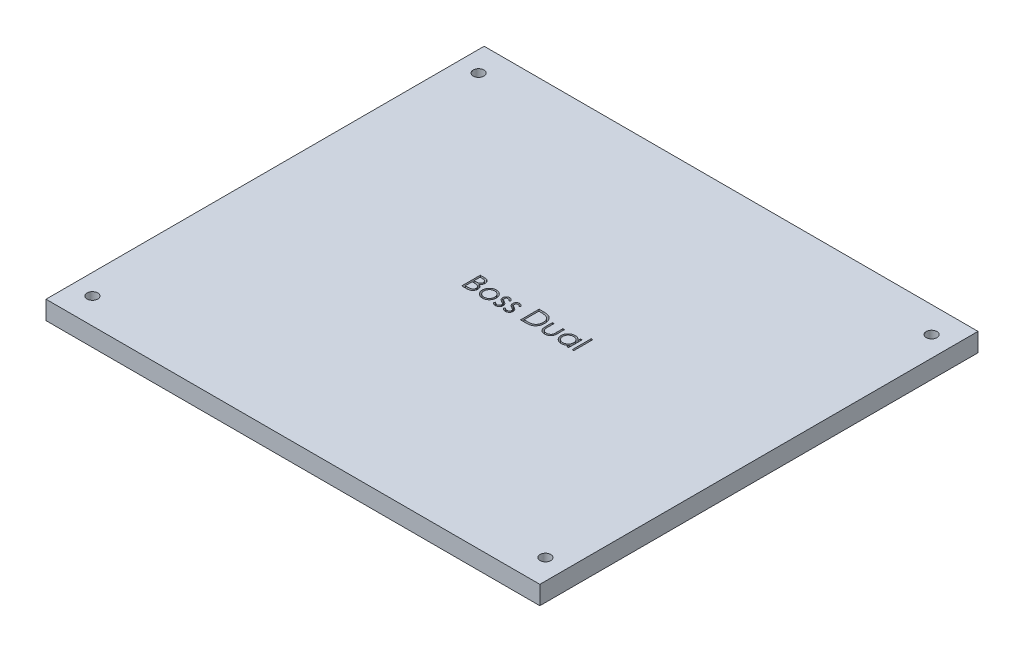
from build123d import *

# Parameters (mm, degrees)
SKETCH2_W           = 168.91
SKETCH2_H           = 149.86
BOSS_EXTRUDE1_DEPTH = 6.35
SKETCH3_R           = 1.8288
CUT_EXTRUDE1_DEPTH  = 114.081715697
SKETCH5_W           = 0.569871795
SKETCH5_H           = 6.512820513
CUT_EXTRUDE2_DEPTH  = 2.54


with BuildPart() as part:
    # Sketch2 → Boss-Extrude1 (new body)
    with BuildSketch(Plane(origin=(0, 0, 0), x_dir=(1, 0, 0), z_dir=(0, 1, 0))):
        Rectangle(SKETCH2_W, SKETCH2_H)
    extrude(amount=BOSS_EXTRUDE1_DEPTH)

    # Sketch3 → Cut-Extrude1 (cut, through all)
    with BuildSketch(Plane(origin=(0, 6.35, 0), x_dir=(1, 0, 0), z_dir=(0, 1, 0))):
        with Locations(Location((-77.47, 66.04, 0), (0, 0, 270))):
            Circle(SKETCH3_R)
        with Locations(Location((77.47, 66.04, 0), (0, 0, 270))):
            Circle(SKETCH3_R)
        with Locations(Location((77.47, -66.04, 0), (0, 0, 270))):
            Circle(SKETCH3_R)
        with Locations(Location((-77.47, -66.04, 0), (0, 0, 270))):
            Circle(SKETCH3_R)
    extrude(amount=-CUT_EXTRUDE1_DEPTH, mode=Mode.SUBTRACT)

    # Sketch5 → Cut-Extrude2 (cut)
    # profile 1 of 8: a face of its own
    with BuildSketch(Plane(origin=(0, 6.35, 0), x_dir=(1, 0, 0), z_dir=(0, 1, 0))):
        with BuildLine():
            Line((-17.296209186, 6.449507207), (-16.057246847, 6.449507207))
            add(Edge.make_bspline(
                [(-16.057246847, 6.449507207), (-15.996598036, 6.449188346), (-15.879045548, 6.448570313), (-15.70810456, 6.438985204), (-15.547996004, 6.425915688), (-15.398673445, 6.405178235), (-15.260205885, 6.38015601), (-15.132176029, 6.349854144), (-15.014991002, 6.313520145), (-14.875086466, 6.255741892), (-14.715573267, 6.169884144), (-14.542856183, 6.043013747), (-14.395165635, 5.887833421), (-14.267827602, 5.712786317), (-14.166588428, 5.520225703), (-14.093346989, 5.314741175), (-14.0469777, 5.098983157), (-14.04220897, 4.950859106), (-14.03979893, 4.875999595)],
                knots=[0, 0, 0, 0, 1.001505555, 1.941167018, 2.826882275, 3.653841531, 4.429895133, 5.150066043, 5.825578002, 6.45369114, 7.647487171, 8.808567382, 9.977351308, 11.170798116, 12.373658725, 13.556498008, 14.765093433, 16, 16, 16, 16], degree=3))
            add(Edge.make_bspline(
                [(-14.03979893, 4.875999595), (-14.041782341, 4.805872816), (-14.04567993, 4.66806708), (-14.082950364, 4.466510625), (-14.141299006, 4.274647699), (-14.222407101, 4.093178515), (-14.327820722, 3.926203245), (-14.452749386, 3.772374919), (-14.603474442, 3.638206573), (-14.716401463, 3.563198736), (-14.773763273, 3.525098153)],
                knots=[0, 0, 0, 0, 1.044552857, 2.05264487, 3.044412934, 4.028983338, 5.005914585, 5.980388656, 6.974128949, 8, 8, 8, 8], degree=3))
            add(Edge.make_bspline(
                [(-14.773763273, 3.525098153), (-14.701626497, 3.497403083), (-14.563610976, 3.444415555), (-14.373680639, 3.35073407), (-14.21004142, 3.248839956), (-14.071435169, 3.137566456), (-13.952893995, 3.017626185), (-13.849383659, 2.887260478), (-13.761061737, 2.744768731), (-13.685382576, 2.591636603), (-13.626329833, 2.429427725), (-13.582104977, 2.259663602), (-13.556764034, 2.082952981), (-13.553157885, 1.962692364), (-13.551337392, 1.901981166)],
                knots=[0, 0, 0, 0, 1.27268992, 2.434971085, 3.483601985, 4.442670788, 5.356604649, 6.2567628, 7.179492994, 8.113709626, 9.066344395, 10.018646069, 10.999752585, 12, 12, 12, 12], degree=3))
            add(Edge.make_bspline(
                [(-13.551337392, 1.901981166), (-13.553109669, 1.839992698), (-13.556596676, 1.71802865), (-13.582323196, 1.538858621), (-13.625882576, 1.367635503), (-13.685883084, 1.203251814), (-13.764191855, 1.04602557), (-13.85949259, 0.895778649), (-13.973124141, 0.754020649), (-14.100238204, 0.619176361), (-14.244042382, 0.497931661), (-14.399192394, 0.389953165), (-14.567642146, 0.301151024), (-14.74662505, 0.226554813), (-14.93814888, 0.169573182), (-15.141353611, 0.129708655), (-15.356063987, 0.102848088), (-15.503401678, 0.10063973), (-15.57896159, 0.099507207)],
                knots=[0, 0, 0, 0, 0.978564426, 1.925352924, 2.850884081, 3.763762016, 4.682927383, 5.618979971, 6.567305752, 7.547517671, 8.540179244, 9.531824382, 10.526200242, 11.540722885, 12.589160233, 13.674978461, 14.80764778, 16, 16, 16, 16], degree=3))
            Line((-15.57896159, 0.099507207), (-17.296209186, 0.099507207))
            Line((-17.296209186, 0.099507207), (-17.296209186, 6.449507207))
        make_face()
        with BuildLine():
            Line((-16.726337392, 5.798225156), (-16.726337392, 3.762968746))
            Line((-16.726337392, 3.762968746), (-16.343454779, 3.762968746))
            add(Edge.make_bspline(
                [(-16.343454779, 3.762968746), (-16.287486251, 3.76369432), (-16.179343647, 3.765096278), (-16.022734692, 3.769112231), (-15.877365016, 3.780357252), (-15.743485548, 3.791599042), (-15.621307114, 3.809877223), (-15.511100394, 3.83163436), (-15.411135796, 3.854644773), (-15.295856907, 3.893777985), (-15.165095986, 3.951613196), (-15.025698783, 4.041369242), (-14.902809102, 4.148274854), (-14.799037061, 4.271629885), (-14.714107679, 4.407458536), (-14.65511851, 4.553593591), (-14.615118438, 4.706392973), (-14.611505231, 4.811291803), (-14.609670725, 4.864551278)],
                knots=[0, 0, 0, 0, 1.156816544, 2.235205308, 3.236616184, 4.169592532, 5.011045266, 5.787822928, 6.49130361, 7.128639758, 8.301311294, 9.436451833, 10.541879658, 11.654887649, 12.756523258, 13.837046038, 14.901820046, 16, 16, 16, 16], degree=3))
            add(Edge.make_bspline(
                [(-14.609670725, 4.864551278), (-14.610625366, 4.899795178), (-14.612497999, 4.968929936), (-14.627834705, 5.069712335), (-14.65390159, 5.164497429), (-14.687382951, 5.254584172), (-14.734171, 5.337155672), (-14.789258998, 5.415066898), (-14.855817322, 5.485664599), (-14.931577018, 5.55164926), (-15.018678376, 5.610150046), (-15.117069434, 5.66138686), (-15.228081363, 5.702645126), (-15.349843257, 5.738778717), (-15.484229373, 5.764157478), (-15.62968892, 5.785300053), (-15.787413338, 5.796063742), (-15.896533739, 5.797488615), (-15.952939956, 5.798225156)],
                knots=[0, 0, 0, 0, 0.91205012, 1.789085906, 2.630437955, 3.453916878, 4.269457761, 5.079663411, 5.91843418, 6.774407191, 7.675494373, 8.627863946, 9.638891023, 10.736472738, 11.911756761, 13.175263542, 14.539845004, 16, 16, 16, 16], degree=3))
            Line((-15.952939956, 5.798225156), (-16.726337392, 5.798225156))
        make_face(mode=Mode.SUBTRACT)
        with BuildLine():
            Line((-16.726337392, 3.111686695), (-16.726337392, 0.750789259))
            Line((-16.726337392, 0.750789259), (-15.914778898, 0.750789259))
            add(Edge.make_bspline(
                [(-15.914778898, 0.750789259), (-15.856687418, 0.751485486), (-15.744723749, 0.752827373), (-15.58306866, 0.757208065), (-15.433239315, 0.767172622), (-15.295919411, 0.782858663), (-15.169626161, 0.79987385), (-15.055874615, 0.822754317), (-14.953742678, 0.848968859), (-14.835316434, 0.889489429), (-14.701960069, 0.95243874), (-14.558248944, 1.047351694), (-14.430475662, 1.160423981), (-14.321971835, 1.291290068), (-14.23304827, 1.433586904), (-14.168359087, 1.584436325), (-14.12846139, 1.741345782), (-14.123631454, 1.848328246), (-14.121209186, 1.901981166)],
                knots=[0, 0, 0, 0, 1.160039823, 2.235823828, 3.228722157, 4.157150951, 4.99529583, 5.772374946, 6.472645482, 7.099169577, 8.269452708, 9.405989375, 10.527446681, 11.663510218, 12.788923519, 13.866172445, 14.929861265, 16, 16, 16, 16], degree=3))
            add(Edge.make_bspline(
                [(-14.121209186, 1.901981166), (-14.121710119, 1.935533369), (-14.122703903, 2.002096576), (-14.137691019, 2.099915277), (-14.159487611, 2.194667933), (-14.187666069, 2.286611833), (-14.228704245, 2.374084673), (-14.276613263, 2.45881646), (-14.332786092, 2.540919201), (-14.420314793, 2.644718575), (-14.547626822, 2.76431087), (-14.7285234, 2.881400338), (-14.93421314, 2.975829931), (-15.083397306, 3.015924695), (-15.160461991, 3.036636614)],
                knots=[0, 0, 0, 0, 0.723448775, 1.435228256, 2.130040452, 2.821711965, 3.505591119, 4.210454504, 4.921174351, 5.648778258, 7.137944449, 8.670945889, 10.280296675, 12, 12, 12, 12], degree=3))
            add(Edge.make_bspline(
                [(-15.160461991, 3.036636614), (-15.191357636, 3.042905124), (-15.258345768, 3.056496545), (-15.367579521, 3.070843379), (-15.492286026, 3.08362513), (-15.632753246, 3.093079659), (-15.789158901, 3.102852388), (-15.961837025, 3.106652992), (-16.150082439, 3.111187364), (-16.280697171, 3.111515993), (-16.34854292, 3.111686695)],
                knots=[0, 0, 0, 0, 0.634451884, 1.375622551, 2.216452059, 3.157844607, 4.20941857, 5.370758133, 6.634282058, 8, 8, 8, 8], degree=3))
            Line((-16.34854292, 3.111686695), (-16.726337392, 3.111686695))
        make_face(mode=Mode.SUBTRACT)
    # profile 2 of 8: a face of its own
    with BuildSketch(Plane(origin=(0, 6.35, 0), x_dir=(1, 0, 0), z_dir=(0, 1, 0))):
        with BuildLine():
            add(Edge.make_bspline(
                [(-10.17026768, 4.821302079), (-10.083197799, 4.819448077), (-9.912475042, 4.815812831), (-9.662452163, 4.776959965), (-9.423791702, 4.717546889), (-9.195579611, 4.635411341), (-8.980738618, 4.525316945), (-8.776139361, 4.393945802), (-8.582342787, 4.238311668), (-8.46618672, 4.117919173), (-8.407226815, 4.05680889)],
                knots=[0, 0, 0, 0, 1.054011418, 2.066658804, 3.057071809, 4.030435133, 4.997543892, 5.974964718, 6.972108034, 8, 8, 8, 8], degree=3))
            add(Edge.make_bspline(
                [(-8.407226815, 4.05680889), (-8.356459555, 3.998363516), (-8.255907522, 3.882603846), (-8.126974004, 3.694905806), (-8.015900602, 3.500523052), (-7.926886373, 3.296874331), (-7.856700687, 3.085737427), (-7.806870067, 2.866386636), (-7.777230199, 2.639306377), (-7.773233388, 2.485085128), (-7.771209186, 2.406979163)],
                knots=[0, 0, 0, 0, 1.025258237, 2.030674902, 3.01204498, 3.988269485, 4.97094183, 5.956517959, 6.965070386, 8, 8, 8, 8], degree=3))
            add(Edge.make_bspline(
                [(-7.771209186, 2.406979163), (-7.772989613, 2.328420486), (-7.776507818, 2.173184879), (-7.809788379, 1.944549744), (-7.861551921, 1.722853423), (-7.935632542, 1.509024078), (-8.030625111, 1.302408091), (-8.146541073, 1.103907909), (-8.284193864, 0.913131896), (-8.440229687, 0.731699989), (-8.612680948, 0.564484143), (-8.799763102, 0.418745711), (-8.997799707, 0.293883802), (-9.209424076, 0.193306305), (-9.432703659, 0.11400442), (-9.668120054, 0.058305819), (-9.915307539, 0.024629621), (-10.084085498, 0.020305138), (-10.17026768, 0.018096951)],
                knots=[0, 0, 0, 0, 0.998656419, 1.973391657, 2.932242238, 3.890759089, 4.846373663, 5.82037756, 6.809684879, 7.83454468, 8.860553229, 9.859544525, 10.845671541, 11.83227036, 12.833544569, 13.85385346, 14.904124723, 16, 16, 16, 16], degree=3))
            add(Edge.make_bspline(
                [(-10.17026768, 0.018096951), (-10.2568721, 0.02031255), (-10.426491231, 0.024651912), (-10.674551227, 0.058174982), (-10.910389535, 0.113978751), (-11.133961421, 0.193566916), (-11.346495644, 0.293887017), (-11.545679717, 0.418368225), (-11.732913849, 0.564527364), (-11.905401592, 0.731688278), (-12.061427633, 0.913134913), (-12.199082948, 1.103907126), (-12.314998254, 1.302408295), (-12.409990996, 1.509024024), (-12.484071571, 1.722853437), (-12.535835125, 1.94454974), (-12.569115682, 2.17318488), (-12.572633888, 2.328420487), (-12.574414315, 2.406979163)],
                knots=[0, 0, 0, 0, 1.099876186, 2.154163076, 3.173186993, 4.173200201, 5.163417411, 6.152872554, 7.150605724, 8.17532212, 9.198891216, 10.186952605, 11.159729845, 12.11414092, 13.071450619, 14.029093627, 15.002601286, 16, 16, 16, 16], degree=3))
            add(Edge.make_bspline(
                [(-12.574414315, 2.406979163), (-12.572376309, 2.48466061), (-12.568341407, 2.638456526), (-12.538731341, 2.865109907), (-12.489095103, 3.084089456), (-12.418825283, 3.294411391), (-12.32899058, 3.497167682), (-12.219477957, 3.692030733), (-12.089229238, 3.878880028), (-11.989077126, 3.994490087), (-11.938396686, 4.052992784)],
                knots=[0, 0, 0, 0, 1.031353054, 2.041901799, 3.029428768, 4.008703097, 4.981709435, 5.96992636, 6.972712378, 8, 8, 8, 8], degree=3))
            add(Edge.make_bspline(
                [(-11.938396686, 4.052992784), (-11.879525671, 4.114633031), (-11.763745461, 4.235859423), (-11.568984198, 4.39103986), (-11.364888265, 4.525144736), (-11.147673042, 4.633051584), (-10.919648429, 4.718030038), (-10.679764946, 4.777113187), (-10.428893653, 4.815672845), (-10.257335484, 4.819406968), (-10.17026768, 4.821302079)],
                knots=[0, 0, 0, 0, 1.027980169, 2.021703884, 2.998553061, 3.971491411, 4.943284454, 5.930300938, 6.949603206, 8, 8, 8, 8], degree=3))
        make_face()
        with BuildLine():
            add(Edge.make_bspline(
                [(-10.172811751, 4.251430284), (-10.234384274, 4.249680239), (-10.355939836, 4.246225327), (-10.53486394, 4.219947385), (-10.707112505, 4.178314057), (-10.873012322, 4.119160983), (-11.032003935, 4.042781552), (-11.184239565, 3.948967813), (-11.330166991, 3.838962306), (-11.466931592, 3.712937173), (-11.592448073, 3.575270998), (-11.702172402, 3.428588975), (-11.795472238, 3.275270318), (-11.873196526, 3.115155592), (-11.931085281, 2.946622213), (-11.973127765, 2.771578782), (-11.999380916, 2.589668669), (-12.002803345, 2.466005107), (-12.00454252, 2.403163057)],
                knots=[0, 0, 0, 0, 1.021534396, 2.016698045, 2.994645724, 3.958388632, 4.93408049, 5.916473867, 6.921342795, 7.962252576, 8.998418191, 10.008913653, 10.997312074, 11.973003931, 12.956656626, 13.948281152, 14.957379055, 16, 16, 16, 16], degree=3))
            add(Edge.make_bspline(
                [(-12.00454252, 2.403163057), (-12.001627283, 2.321970093), (-11.995841082, 2.160817243), (-11.948787153, 1.923488492), (-11.870072045, 1.695647132), (-11.763777981, 1.478628831), (-11.630598127, 1.277837698), (-11.473685877, 1.098819434), (-11.294725278, 0.944268033), (-11.095849628, 0.816032785), (-10.881121079, 0.714142942), (-10.653870325, 0.641936229), (-10.416850781, 0.594997587), (-10.254870025, 0.590332198), (-10.172811751, 0.587968746)],
                knots=[0, 0, 0, 0, 1.016792936, 2.018143844, 3.017858371, 4.030088057, 5.03801393, 6.028138512, 7.003788237, 7.991172063, 8.984598303, 9.972568034, 10.972917682, 12, 12, 12, 12], degree=3))
            add(Edge.make_bspline(
                [(-10.172811751, 0.587968746), (-10.090758196, 0.590345969), (-9.928786757, 0.59503854), (-9.692096536, 0.641699828), (-9.465466902, 0.714459326), (-9.250961384, 0.815918193), (-9.052176261, 0.944755002), (-8.871928569, 1.097946715), (-8.716356089, 1.278311845), (-8.583307977, 1.478894791), (-8.475273173, 1.695310687), (-8.396926507, 1.923530543), (-8.349759458, 2.160806534), (-8.343988526, 2.321966505), (-8.341080981, 2.403163057)],
                knots=[0, 0, 0, 0, 1.02726834, 2.027799167, 3.010890988, 4.004497153, 4.992059811, 5.971914811, 6.958719428, 7.966827853, 8.981595046, 9.981490638, 10.983022906, 12, 12, 12, 12], degree=3))
            add(Edge.make_bspline(
                [(-8.341080981, 2.403163057), (-8.342819557, 2.466005483), (-8.346240808, 2.589669784), (-8.372502529, 2.771574521), (-8.414513294, 2.946637846), (-8.472518943, 3.115097909), (-8.549905511, 3.275684882), (-8.64500455, 3.428138815), (-8.754280839, 3.57577912), (-8.881311901, 3.712492154), (-9.017933743, 3.839011435), (-9.163920313, 3.94901047), (-9.315930202, 4.04236925), (-9.474459917, 4.119814286), (-9.640381004, 4.17777589), (-9.812388224, 4.220187778), (-9.990548922, 4.246114278), (-10.1116689, 4.249646949), (-10.172811751, 4.251430284)],
                knots=[0, 0, 0, 0, 1.042956736, 2.052379634, 3.044323526, 4.02829302, 5.004299113, 5.996692471, 7.007513377, 8.048758398, 9.090003419, 10.095195979, 11.07790575, 12.047570684, 13.018257071, 13.989683339, 14.985167495, 16, 16, 16, 16], degree=3))
        make_face(mode=Mode.SUBTRACT)
    # profile 3 of 8: a face of its own
    with BuildSketch(Plane(origin=(0, 6.35, 0), x_dir=(1, 0, 0), z_dir=(0, 1, 0))):
        with BuildLine():
            Line((-4.433388674, 4.161115781), (-4.820087392, 3.762968746))
            add(Edge.make_bspline(
                [(-4.820087392, 3.762968746), (-4.853453019, 3.801636883), (-4.917778022, 3.876184499), (-5.019797995, 3.975856034), (-5.121440818, 4.059561623), (-5.221315094, 4.13023215), (-5.32193224, 4.183661316), (-5.422111505, 4.222659137), (-5.521956617, 4.246792413), (-5.588696995, 4.249902894), (-5.621469603, 4.251430284)],
                knots=[0, 0, 0, 0, 1.26578478, 2.440284043, 3.530471711, 4.527705817, 5.468200915, 6.346673037, 7.188140097, 8, 8, 8, 8], degree=3))
            add(Edge.make_bspline(
                [(-5.621469603, 4.251430284), (-5.661636782, 4.249480158), (-5.740680105, 4.245642584), (-5.853938375, 4.207336789), (-5.959077366, 4.148538078), (-6.050076459, 4.065137934), (-6.12716125, 3.969408474), (-6.183428928, 3.862372285), (-6.217838641, 3.747259406), (-6.222201512, 3.667376664), (-6.224414315, 3.626860973)],
                knots=[0, 0, 0, 0, 0.99966794, 1.967205029, 2.953328237, 3.988086729, 5.028030931, 6.008226631, 6.989793394, 8, 8, 8, 8], degree=3))
            add(Edge.make_bspline(
                [(-6.224414315, 3.626860973), (-6.222398984, 3.59019055), (-6.218374003, 3.516953078), (-6.1870836, 3.408915931), (-6.137252297, 3.303583876), (-6.090679231, 3.239062603), (-6.066681943, 3.205817304)],
                knots=[0, 0, 0, 0, 0.960159726, 1.917612774, 2.927026955, 4, 4, 4, 4], degree=3))
            add(Edge.make_bspline(
                [(-6.066681943, 3.205817304), (-6.05223389, 3.188065272), (-6.02148303, 3.15028231), (-5.963773296, 3.097842462), (-5.898418183, 3.039890092), (-5.819823439, 2.981947545), (-5.731375146, 2.920929987), (-5.631155302, 2.859240402), (-5.522344414, 2.792176374), (-5.444443872, 2.74964147), (-5.403951574, 2.727532047)],
                knots=[0, 0, 0, 0, 0.66740084, 1.420478572, 2.27185888, 3.217733974, 4.268547843, 5.408967954, 6.65319498, 8, 8, 8, 8], degree=3))
            add(Edge.make_bspline(
                [(-5.403951574, 2.727532047), (-5.35457837, 2.699873438), (-5.259205597, 2.646446112), (-5.123691577, 2.56351565), (-5.000706517, 2.481090066), (-4.889208377, 2.400050869), (-4.791342524, 2.318130666), (-4.704139692, 2.23846945), (-4.629774944, 2.158660276), (-4.588129963, 2.102901627), (-4.568224411, 2.076249996)],
                knots=[0, 0, 0, 0, 1.27191281, 2.456916733, 3.569705269, 4.599008579, 5.553216877, 6.436649441, 7.252746552, 8, 8, 8, 8], degree=3))
            add(Edge.make_bspline(
                [(-4.568224411, 2.076249996), (-4.535185311, 2.022427236), (-4.469431371, 1.915309955), (-4.400382802, 1.738927951), (-4.36035916, 1.551856039), (-4.354803418, 1.42389044), (-4.351978417, 1.358822111)],
                knots=[0, 0, 0, 0, 0.995354457, 1.980940102, 2.973342416, 4, 4, 4, 4], degree=3))
            add(Edge.make_bspline(
                [(-4.351978417, 1.358822111), (-4.353283857, 1.31297666), (-4.355856369, 1.222633191), (-4.373741719, 1.089582857), (-4.404502891, 0.962338731), (-4.446401558, 0.839520143), (-4.502978921, 0.723480353), (-4.569287067, 0.611291729), (-4.648888693, 0.505381112), (-4.73976876, 0.40588757), (-4.839274156, 0.315017714), (-4.945421007, 0.235145683), (-5.058340028, 0.168789386), (-5.177224368, 0.113879402), (-5.30234414, 0.070212706), (-5.433718908, 0.039982114), (-5.570931077, 0.021888676), (-5.664239443, 0.01937684), (-5.711784106, 0.018096951)],
                knots=[0, 0, 0, 0, 1.032770009, 2.035186124, 3.017557409, 3.978232242, 4.952395191, 5.920591857, 6.910227898, 7.931268572, 8.952309245, 9.941945286, 10.918353717, 11.897095711, 12.887975737, 13.898235213, 14.929059601, 16, 16, 16, 16], degree=3))
            add(Edge.make_bspline(
                [(-5.711784106, 0.018096951), (-5.775950268, 0.019897993), (-5.903391006, 0.023475052), (-6.09187664, 0.057050334), (-6.276064302, 0.109293406), (-6.454560154, 0.181349458), (-6.623372389, 0.27233718), (-6.777824209, 0.381307523), (-6.918452148, 0.504660804), (-6.998495302, 0.599208513), (-7.038516879, 0.646482368)],
                knots=[0, 0, 0, 0, 1.013940152, 2.01379169, 3.017749504, 4.037548394, 5.051665909, 6.043208538, 7.021604269, 8, 8, 8, 8], degree=3))
            Line((-7.038516879, 0.646482368), (-6.660722408, 1.076430284))
            add(Edge.make_bspline(
                [(-6.660722408, 1.076430284), (-6.624849601, 1.03768664), (-6.555304742, 0.962576228), (-6.44408682, 0.862564924), (-6.330912764, 0.778742618), (-6.21691269, 0.708632422), (-6.10039909, 0.654611334), (-5.982024904, 0.616659028), (-5.862030906, 0.592267422), (-5.78143646, 0.589403967), (-5.741040917, 0.587968746)],
                knots=[0, 0, 0, 0, 1.179806542, 2.287233372, 3.337373186, 4.324005949, 5.273901747, 6.200048787, 7.097828587, 8, 8, 8, 8], degree=3))
            add(Edge.make_bspline(
                [(-5.741040917, 0.587968746), (-5.686035537, 0.590455814), (-5.578564252, 0.595315127), (-5.424633433, 0.63943328), (-5.282504782, 0.708611907), (-5.159090998, 0.806737002), (-5.054039934, 0.920956398), (-4.977970246, 1.049614872), (-4.930297757, 1.188936515), (-4.924698873, 1.285515121), (-4.921850212, 1.334653441)],
                knots=[0, 0, 0, 0, 1.072336372, 2.095165389, 3.102688358, 4.141489647, 5.156069229, 6.117746104, 7.042326257, 8, 8, 8, 8], degree=3))
            add(Edge.make_bspline(
                [(-4.921850212, 1.334653441), (-4.92382106, 1.375129464), (-4.927712237, 1.455043952), (-4.958270744, 1.570705285), (-5.006554062, 1.680413837), (-5.054096781, 1.744620768), (-5.078310549, 1.777321711)],
                knots=[0, 0, 0, 0, 1.013901739, 2.00181326, 2.98231254, 4, 4, 4, 4], degree=3))
            add(Edge.make_bspline(
                [(-5.078310549, 1.777321711), (-5.092865464, 1.793714439), (-5.124571327, 1.829423722), (-5.182728693, 1.880994937), (-5.252364358, 1.936581202), (-5.33426151, 1.995239942), (-5.428585249, 2.056197412), (-5.535717868, 2.119133808), (-5.654191728, 2.187038396), (-5.737958445, 2.232068342), (-5.781746045, 2.255606967)],
                knots=[0, 0, 0, 0, 0.615000592, 1.339693406, 2.178160186, 3.116406724, 4.166410947, 5.330106347, 6.604359322, 8, 8, 8, 8], degree=3))
            add(Edge.make_bspline(
                [(-5.781746045, 2.255606967), (-5.829002092, 2.281985106), (-5.920646649, 2.333140735), (-6.050453876, 2.412817052), (-6.167561219, 2.493856251), (-6.274786547, 2.571712402), (-6.369421515, 2.6504904), (-6.451093307, 2.730277699), (-6.523017427, 2.807856531), (-6.562836302, 2.862824484), (-6.581856222, 2.889080525)],
                knots=[0, 0, 0, 0, 1.262093308, 2.447601706, 3.550203992, 4.582594899, 5.537233252, 6.418365656, 7.244515135, 8, 8, 8, 8], degree=3))
            add(Edge.make_bspline(
                [(-6.581856222, 2.889080525), (-6.61475031, 2.941958998), (-6.680549981, 3.047734423), (-6.744440399, 3.22428343), (-6.788357051, 3.410148034), (-6.792280245, 3.538394184), (-6.79428611, 3.603964339)],
                knots=[0, 0, 0, 0, 0.985009483, 1.970363186, 2.962279964, 4, 4, 4, 4], degree=3))
            add(Edge.make_bspline(
                [(-6.79428611, 3.603964339), (-6.793316927, 3.646827561), (-6.791420098, 3.730716959), (-6.776281605, 3.85397739), (-6.7487195, 3.971086184), (-6.714148426, 4.083802064), (-6.66610069, 4.189941577), (-6.608685976, 4.290920132), (-6.541217362, 4.386598154), (-6.463487392, 4.475503837), (-6.378022478, 4.556256472), (-6.285684825, 4.626648268), (-6.18855113, 4.686712655), (-6.086210141, 4.737086589), (-5.977678711, 4.775189097), (-5.863715467, 4.801418925), (-5.744551086, 4.818936221), (-5.663087615, 4.820502103), (-5.621469603, 4.821302079)],
                knots=[0, 0, 0, 0, 1.087655834, 2.128696564, 3.144119009, 4.137814668, 5.115653402, 6.093965665, 7.082169637, 8.081268856, 9.086088321, 10.061021666, 11.022561449, 11.980240094, 12.950172527, 13.934149372, 14.944599409, 16, 16, 16, 16], degree=3))
            add(Edge.make_bspline(
                [(-5.621469603, 4.821302079), (-5.572135431, 4.81929849), (-5.472541628, 4.815253725), (-5.323126807, 4.783130544), (-5.173932029, 4.730274769), (-5.024573951, 4.657274746), (-4.876146712, 4.562810557), (-4.727344701, 4.448638828), (-4.57638156, 4.315510689), (-4.482117963, 4.213730665), (-4.433388674, 4.161115781)],
                knots=[0, 0, 0, 0, 0.845714091, 1.707292901, 2.609013841, 3.555613372, 4.552488639, 5.621697636, 6.770543573, 8, 8, 8, 8], degree=3))
        make_face()
    # profile 4 of 8: a face of its own
    with BuildSketch(Plane(origin=(0, 6.35, 0), x_dir=(1, 0, 0), z_dir=(0, 1, 0))):
        with BuildLine():
            Line((-1.014157904, 4.161115781), (-1.400856622, 3.762968746))
            add(Edge.make_bspline(
                [(-1.400856622, 3.762968746), (-1.43422225, 3.801636883), (-1.498547253, 3.876184499), (-1.600567225, 3.975856034), (-1.702210049, 4.059561623), (-1.802084325, 4.13023215), (-1.90270147, 4.183661316), (-2.002880736, 4.222659137), (-2.102725847, 4.246792413), (-2.169466226, 4.249902894), (-2.202238834, 4.251430284)],
                knots=[0, 0, 0, 0, 1.26578478, 2.440284043, 3.530471711, 4.527705817, 5.468200915, 6.346673037, 7.188140097, 8, 8, 8, 8], degree=3))
            add(Edge.make_bspline(
                [(-2.202238834, 4.251430284), (-2.242406013, 4.249480158), (-2.321449336, 4.245642584), (-2.434707606, 4.207336789), (-2.539846597, 4.148538078), (-2.63084569, 4.065137934), (-2.70793048, 3.969408474), (-2.764198159, 3.862372285), (-2.798607872, 3.747259406), (-2.802970743, 3.667376664), (-2.805183545, 3.626860973)],
                knots=[0, 0, 0, 0, 0.99966794, 1.967205029, 2.953328237, 3.988086729, 5.028030931, 6.008226631, 6.989793394, 8, 8, 8, 8], degree=3))
            add(Edge.make_bspline(
                [(-2.805183545, 3.626860973), (-2.803168215, 3.59019055), (-2.799143234, 3.516953078), (-2.76785283, 3.408915931), (-2.718021528, 3.303583876), (-2.671448461, 3.239062603), (-2.647451174, 3.205817304)],
                knots=[0, 0, 0, 0, 0.960159726, 1.917612774, 2.927026955, 4, 4, 4, 4], degree=3))
            add(Edge.make_bspline(
                [(-2.647451174, 3.205817304), (-2.633003121, 3.188065272), (-2.602252261, 3.15028231), (-2.544542527, 3.097842462), (-2.479187414, 3.039890092), (-2.40059267, 2.981947545), (-2.312144377, 2.920929987), (-2.211924532, 2.859240402), (-2.103113645, 2.792176374), (-2.025213103, 2.74964147), (-1.984720805, 2.727532047)],
                knots=[0, 0, 0, 0, 0.66740084, 1.420478572, 2.27185888, 3.217733974, 4.268547843, 5.408967954, 6.65319498, 8, 8, 8, 8], degree=3))
            add(Edge.make_bspline(
                [(-1.984720805, 2.727532047), (-1.935347601, 2.699873438), (-1.839974828, 2.646446112), (-1.704460808, 2.56351565), (-1.581475747, 2.481090066), (-1.469977608, 2.400050869), (-1.372111754, 2.318130666), (-1.284908923, 2.23846945), (-1.210544175, 2.158660276), (-1.168899194, 2.102901627), (-1.148993642, 2.076249996)],
                knots=[0, 0, 0, 0, 1.27191281, 2.456916733, 3.569705269, 4.599008579, 5.553216877, 6.436649441, 7.252746552, 8, 8, 8, 8], degree=3))
            add(Edge.make_bspline(
                [(-1.148993642, 2.076249996), (-1.115954542, 2.022427236), (-1.050200602, 1.915309955), (-0.981152032, 1.738927951), (-0.941128391, 1.551856039), (-0.935572648, 1.42389044), (-0.932747648, 1.358822111)],
                knots=[0, 0, 0, 0, 0.995354457, 1.980940102, 2.973342416, 4, 4, 4, 4], degree=3))
            add(Edge.make_bspline(
                [(-0.932747648, 1.358822111), (-0.934053088, 1.31297666), (-0.9366256, 1.222633191), (-0.95451095, 1.089582857), (-0.985272121, 0.962338731), (-1.027170789, 0.839520143), (-1.083748151, 0.723480353), (-1.150056298, 0.611291729), (-1.229657923, 0.505381112), (-1.32053799, 0.40588757), (-1.420043387, 0.315017714), (-1.526190238, 0.235145683), (-1.639109259, 0.168789386), (-1.757993599, 0.113879402), (-1.883113371, 0.070212706), (-2.014488139, 0.039982114), (-2.151700308, 0.021888676), (-2.245008674, 0.01937684), (-2.292553337, 0.018096951)],
                knots=[0, 0, 0, 0, 1.032770009, 2.035186124, 3.017557409, 3.978232242, 4.952395191, 5.920591857, 6.910227898, 7.931268572, 8.952309245, 9.941945286, 10.918353717, 11.897095711, 12.887975737, 13.898235213, 14.929059601, 16, 16, 16, 16], degree=3))
            add(Edge.make_bspline(
                [(-2.292553337, 0.018096951), (-2.356719498, 0.019897993), (-2.484160237, 0.023475052), (-2.67264587, 0.057050334), (-2.856833533, 0.109293406), (-3.035329384, 0.181349458), (-3.20414162, 0.27233718), (-3.35859344, 0.381307523), (-3.499221379, 0.504660804), (-3.579264533, 0.599208513), (-3.61928611, 0.646482368)],
                knots=[0, 0, 0, 0, 1.013940152, 2.01379169, 3.017749504, 4.037548394, 5.051665909, 6.043208538, 7.021604269, 8, 8, 8, 8], degree=3))
            Line((-3.61928611, 0.646482368), (-3.241491638, 1.076430284))
            add(Edge.make_bspline(
                [(-3.241491638, 1.076430284), (-3.205618832, 1.03768664), (-3.136073973, 0.962576228), (-3.024856051, 0.862564924), (-2.911681995, 0.778742618), (-2.79768192, 0.708632422), (-2.681168321, 0.654611334), (-2.562794135, 0.616659028), (-2.442800137, 0.592267422), (-2.36220569, 0.589403967), (-2.321810148, 0.587968746)],
                knots=[0, 0, 0, 0, 1.179806542, 2.287233372, 3.337373186, 4.324005949, 5.273901747, 6.200048787, 7.097828587, 8, 8, 8, 8], degree=3))
            add(Edge.make_bspline(
                [(-2.321810148, 0.587968746), (-2.266804768, 0.590455814), (-2.159333483, 0.595315127), (-2.005402663, 0.63943328), (-1.863274013, 0.708611907), (-1.739860229, 0.806737002), (-1.634809165, 0.920956398), (-1.558739477, 1.049614872), (-1.511066987, 1.188936515), (-1.505468104, 1.285515121), (-1.502619443, 1.334653441)],
                knots=[0, 0, 0, 0, 1.072336372, 2.095165389, 3.102688358, 4.141489647, 5.156069229, 6.117746104, 7.042326257, 8, 8, 8, 8], degree=3))
            add(Edge.make_bspline(
                [(-1.502619443, 1.334653441), (-1.504590291, 1.375129464), (-1.508481467, 1.455043952), (-1.539039975, 1.570705285), (-1.587323293, 1.680413837), (-1.634866012, 1.744620768), (-1.659079779, 1.777321711)],
                knots=[0, 0, 0, 0, 1.013901739, 2.00181326, 2.98231254, 4, 4, 4, 4], degree=3))
            add(Edge.make_bspline(
                [(-1.659079779, 1.777321711), (-1.673634695, 1.793714439), (-1.705340558, 1.829423722), (-1.763497924, 1.880994937), (-1.833133589, 1.936581202), (-1.915030741, 1.995239942), (-2.009354479, 2.056197412), (-2.116487099, 2.119133808), (-2.234960959, 2.187038396), (-2.318727675, 2.232068342), (-2.362515276, 2.255606967)],
                knots=[0, 0, 0, 0, 0.615000592, 1.339693406, 2.178160186, 3.116406724, 4.166410947, 5.330106347, 6.604359322, 8, 8, 8, 8], degree=3))
            add(Edge.make_bspline(
                [(-2.362515276, 2.255606967), (-2.409771323, 2.281985106), (-2.501415879, 2.333140735), (-2.631223107, 2.412817052), (-2.74833045, 2.493856251), (-2.855555778, 2.571712402), (-2.950190745, 2.6504904), (-3.031862537, 2.730277699), (-3.103786657, 2.807856531), (-3.143605533, 2.862824484), (-3.162625453, 2.889080525)],
                knots=[0, 0, 0, 0, 1.262093308, 2.447601706, 3.550203992, 4.582594899, 5.537233252, 6.418365656, 7.244515135, 8, 8, 8, 8], degree=3))
            add(Edge.make_bspline(
                [(-3.162625453, 2.889080525), (-3.19551954, 2.941958998), (-3.261319211, 3.047734423), (-3.32520963, 3.22428343), (-3.369126282, 3.410148034), (-3.373049476, 3.538394184), (-3.37505534, 3.603964339)],
                knots=[0, 0, 0, 0, 0.985009483, 1.970363186, 2.962279964, 4, 4, 4, 4], degree=3))
            add(Edge.make_bspline(
                [(-3.37505534, 3.603964339), (-3.374086157, 3.646827561), (-3.372189329, 3.730716959), (-3.357050835, 3.85397739), (-3.329488731, 3.971086184), (-3.294917657, 4.083802064), (-3.24686992, 4.189941577), (-3.189455207, 4.290920132), (-3.121986593, 4.386598154), (-3.044256622, 4.475503837), (-2.958791709, 4.556256472), (-2.866454055, 4.626648268), (-2.769320361, 4.686712655), (-2.666979371, 4.737086589), (-2.558447942, 4.775189097), (-2.444484698, 4.801418925), (-2.325320317, 4.818936221), (-2.243856846, 4.820502103), (-2.202238834, 4.821302079)],
                knots=[0, 0, 0, 0, 1.087655834, 2.128696564, 3.144119009, 4.137814668, 5.115653402, 6.093965665, 7.082169637, 8.081268856, 9.086088321, 10.061021666, 11.022561449, 11.980240094, 12.950172527, 13.934149372, 14.944599409, 16, 16, 16, 16], degree=3))
            add(Edge.make_bspline(
                [(-2.202238834, 4.821302079), (-2.152904662, 4.81929849), (-2.053310859, 4.815253725), (-1.903896038, 4.783130544), (-1.75470126, 4.730274769), (-1.605343182, 4.657274746), (-1.456915943, 4.562810557), (-1.308113931, 4.448638828), (-1.157150791, 4.315510689), (-1.062887194, 4.213730665), (-1.014157904, 4.161115781)],
                knots=[0, 0, 0, 0, 0.845714091, 1.707292901, 2.609013841, 3.555613372, 4.552488639, 5.621697636, 6.770543573, 8, 8, 8, 8], degree=3))
        make_face()
    # profile 5 of 8: a face of its own
    with BuildSketch(Plane(origin=(0, 6.35, 0), x_dir=(1, 0, 0), z_dir=(0, 1, 0))):
        with BuildLine():
            Line((2.812124147, 0.099507207), (2.812124147, 6.449507207))
            Line((2.812124147, 6.449507207), (4.094335685, 6.449507207))
            add(Edge.make_bspline(
                [(4.094335685, 6.449507207), (4.205857992, 6.448704259), (4.42131851, 6.447152967), (4.732672521, 6.437317014), (5.020751633, 6.419917169), (5.284608392, 6.394572457), (5.524967162, 6.363451954), (5.741154923, 6.324444077), (5.934289525, 6.278382682), (6.053069796, 6.239111651), (6.109239531, 6.220540861)],
                knots=[0, 0, 0, 0, 1.314313732, 2.53924729, 3.670748893, 4.714932338, 5.66265055, 6.526160246, 7.303039223, 8, 8, 8, 8], degree=3))
            add(Edge.make_bspline(
                [(6.109239531, 6.220540861), (6.182708558, 6.192545152), (6.327980579, 6.137188585), (6.534822073, 6.032765009), (6.729540945, 5.91444981), (6.913181394, 5.782087031), (7.081548608, 5.631928856), (7.241220077, 5.470353858), (7.385663933, 5.29148644), (7.517940413, 5.099036105), (7.637203681, 4.895269953), (7.740870439, 4.680576256), (7.826965541, 4.456045321), (7.898436109, 4.222301553), (7.954763254, 3.978830982), (7.99319333, 3.72535011), (8.018540697, 3.462860724), (8.021088048, 3.284744197), (8.022380557, 3.194368986)],
                knots=[0, 0, 0, 0, 0.984719456, 1.947108742, 2.898477687, 3.838006223, 4.779231079, 5.722358779, 6.681677486, 7.655904652, 8.64651281, 9.637519902, 10.640069247, 11.656948941, 12.698408672, 13.768548281, 14.867775369, 16, 16, 16, 16], degree=3))
            add(Edge.make_bspline(
                [(8.022380557, 3.194368986), (8.02123943, 3.115880739), (8.018990721, 2.961211451), (7.998798962, 2.733262969), (7.969450496, 2.512076918), (7.924013165, 2.298706576), (7.86885432, 2.091282524), (7.798162217, 1.892015452), (7.717180674, 1.699077398), (7.622747322, 1.51507712), (7.519076524, 1.34075443), (7.407821361, 1.176424544), (7.2891005, 1.024432356), (7.161781851, 0.884317588), (7.027510709, 0.756291467), (6.885407995, 0.639284525), (6.735107031, 0.535586204), (6.577281006, 0.441121594), (6.407325743, 0.358716091), (6.2220221, 0.288993074), (6.02057982, 0.231214214), (5.803493355, 0.183007018), (5.570387617, 0.144766769), (5.321034064, 0.119137457), (5.05581581, 0.101805707), (4.873699143, 0.100288251), (4.779962689, 0.099507207)],
                knots=[0, 0, 0, 0, 1.105936401, 2.179363191, 3.223086493, 4.248585256, 5.251745608, 6.245858792, 7.225916811, 8.198733463, 9.158002045, 10.082870192, 10.993790845, 11.873723703, 12.748670949, 13.606408763, 14.465103618, 15.319838547, 16.196477973, 17.123216899, 18.106603292, 19.147568657, 20.255746949, 21.433717677, 22.679120308, 24, 24, 24, 24], degree=3))
            Line((4.779962689, 0.099507207), (2.812124147, 0.099507207))
        make_face()
        with BuildLine():
            Line((3.381995942, 0.750789259), (4.110872144, 0.750789259))
            add(Edge.make_bspline(
                [(4.110872144, 0.750789259), (4.215607902, 0.751239376), (4.417053122, 0.752105118), (4.706718346, 0.7597019), (4.971385251, 0.77211513), (5.211091418, 0.789487057), (5.425701505, 0.812471544), (5.615664022, 0.838098154), (5.780356277, 0.870024957), (5.880013969, 0.898964555), (5.926066455, 0.912337736)],
                knots=[0, 0, 0, 0, 1.375205317, 2.645023457, 3.804390687, 4.853969522, 5.800190428, 6.637939096, 7.370582563, 8, 8, 8, 8], degree=3))
            add(Edge.make_bspline(
                [(5.926066455, 0.912337736), (5.984029911, 0.932751278), (6.098572369, 0.973090783), (6.263456624, 1.046673969), (6.417230047, 1.13383601), (6.562572521, 1.230722992), (6.69742231, 1.340752167), (6.823377493, 1.461530961), (6.940184475, 1.593674053), (7.046636434, 1.737017432), (7.1419015, 1.890668919), (7.224399302, 2.053117945), (7.296701366, 2.222584587), (7.35344967, 2.401671203), (7.397927944, 2.588776781), (7.429432449, 2.783914482), (7.449053449, 2.987047865), (7.451342076, 3.125209576), (7.452508762, 3.195641022)],
                knots=[0, 0, 0, 0, 0.998632004, 1.973411704, 2.929992603, 3.868527914, 4.809262121, 5.754881198, 6.702106254, 7.672490631, 8.653608572, 9.636854334, 10.631411391, 11.644891563, 12.686317036, 13.754757253, 14.855430412, 16, 16, 16, 16], degree=3))
            add(Edge.make_bspline(
                [(7.452508762, 3.195641022), (7.451577512, 3.26990605), (7.449748064, 3.415800356), (7.426753243, 3.629869189), (7.39314985, 3.835755512), (7.344556591, 4.033473095), (7.282633425, 4.223407677), (7.205354575, 4.404508788), (7.117059423, 4.57868905), (7.012006226, 4.741928257), (6.896952221, 4.896311469), (6.76926664, 5.037743959), (6.630978084, 5.166547903), (6.483594857, 5.284729228), (6.322963263, 5.387533326), (6.152867281, 5.479493447), (5.970811563, 5.557536564), (5.844151386, 5.599045358), (5.7797824, 5.62014022)],
                knots=[0, 0, 0, 0, 1.122418816, 2.205001699, 3.251619955, 4.274784885, 5.280384055, 6.268708349, 7.249350384, 8.229342522, 9.199999885, 10.157847722, 11.105861043, 12.055065948, 13.010012805, 13.98527497, 14.976112212, 16, 16, 16, 16], degree=3))
            add(Edge.make_bspline(
                [(5.7797824, 5.62014022), (5.726531034, 5.634865739), (5.613304021, 5.666176233), (5.428538136, 5.700330838), (5.220593508, 5.730456143), (4.988546907, 5.755961443), (4.732662846, 5.774262726), (4.452744526, 5.787999254), (4.148670958, 5.797264144), (3.937882646, 5.797896799), (3.828480317, 5.798225156)],
                knots=[0, 0, 0, 0, 0.674548936, 1.434276114, 2.292660221, 3.240891867, 4.284742987, 5.42552168, 6.663806718, 8, 8, 8, 8], degree=3))
            Line((3.828480317, 5.798225156), (3.381995942, 5.798225156))
            Line((3.381995942, 5.798225156), (3.381995942, 0.750789259))
        make_face(mode=Mode.SUBTRACT)
    # profile 6 of 8: a face of its own
    with BuildSketch(Plane(origin=(0, 6.35, 0), x_dir=(1, 0, 0), z_dir=(0, 1, 0))):
        with BuildLine():
            Line((9.08071389, 4.739891823), (9.650585685, 4.739891823))
            Line((9.650585685, 4.739891823), (9.650585685, 2.587608169))
            add(Edge.make_bspline(
                [(9.650585685, 2.587608169), (9.650843141, 2.524429753), (9.651335643, 2.403572401), (9.654675636, 2.229663705), (9.662531663, 2.071064813), (9.672353887, 1.927684104), (9.684985191, 1.799545837), (9.700013574, 1.687097575), (9.716810996, 1.589064127), (9.733253348, 1.530021181), (9.740900189, 1.502562095)],
                knots=[0, 0, 0, 0, 1.388932606, 2.656963016, 3.823490214, 4.879454478, 5.816252168, 6.653371382, 7.373723809, 8, 8, 8, 8], degree=3))
            add(Edge.make_bspline(
                [(9.740900189, 1.502562095), (9.7531674, 1.468049172), (9.77744679, 1.399740841), (9.821485825, 1.301063646), (9.875965807, 1.209668491), (9.935582923, 1.122031102), (10.004343277, 1.040747497), (10.081376889, 0.965954941), (10.164105119, 0.894827518), (10.28703209, 0.810672253), (10.455142472, 0.720474439), (10.675855328, 0.642649169), (10.915167281, 0.596138467), (11.080566129, 0.590742318), (11.165579676, 0.587968746)],
                knots=[0, 0, 0, 0, 0.725840625, 1.436591201, 2.137033971, 2.831655856, 3.53531722, 4.242432219, 4.957935707, 5.694543706, 7.190802206, 8.724350549, 10.316345118, 12, 12, 12, 12], degree=3))
            add(Edge.make_bspline(
                [(11.165579676, 0.587968746), (11.250585325, 0.590801297), (11.415055529, 0.596281759), (11.651738116, 0.641246179), (11.868094254, 0.716367929), (12.061952409, 0.821247091), (12.23243329, 0.949593405), (12.374499878, 1.1001951), (12.491715897, 1.268287559), (12.542895846, 1.393698751), (12.568634564, 1.456768826)],
                knots=[0, 0, 0, 0, 1.157059328, 2.238695713, 3.266970494, 4.264342957, 5.228770407, 6.160125903, 7.074715775, 8, 8, 8, 8], degree=3))
            add(Edge.make_bspline(
                [(12.568634564, 1.456768826), (12.576244095, 1.482107682), (12.593066911, 1.538125705), (12.611141463, 1.633157534), (12.627423701, 1.746486174), (12.641326892, 1.878853209), (12.651242258, 2.029912729), (12.656587192, 2.199617524), (12.662625634, 2.387434849), (12.662717285, 2.518912069), (12.662765172, 2.587608169)],
                knots=[0, 0, 0, 0, 0.557542046, 1.232589297, 2.036731608, 2.971723315, 4.038036528, 5.22795436, 6.551621927, 8, 8, 8, 8], degree=3))
            Line((12.662765172, 2.587608169), (12.662765172, 4.739891823))
            Line((12.662765172, 4.739891823), (13.232636967, 4.739891823))
            Line((13.232636967, 4.739891823), (13.232636967, 2.480757207))
            add(Edge.make_bspline(
                [(13.232636967, 2.480757207), (13.231835607, 2.403999911), (13.230280858, 2.255080255), (13.220288963, 2.038664796), (13.203144666, 1.836984723), (13.177122937, 1.649933281), (13.146523785, 1.477653279), (13.10705169, 1.319923912), (13.059919744, 1.17723115), (13.006751167, 1.047071069), (12.943937207, 0.929057418), (12.87712247, 0.817051008), (12.799970384, 0.713830969), (12.718744387, 0.614259091), (12.628389955, 0.523288034), (12.53060021, 0.438830357), (12.426751549, 0.359594999), (12.314539432, 0.288672249), (12.195602004, 0.224779193), (12.069792435, 0.168144308), (11.935569767, 0.123326775), (11.794665739, 0.084663139), (11.646390011, 0.054338316), (11.490885527, 0.032954117), (11.328204666, 0.019845302), (11.217334646, 0.018689521), (11.160491535, 0.018096951)],
                knots=[0, 0, 0, 0, 1.493040784, 2.896703357, 4.213163133, 5.428574705, 6.569057535, 7.615249723, 8.588095153, 9.490268104, 10.346124644, 11.18633936, 12.024365274, 12.850166724, 13.684164916, 14.514361689, 15.362232829, 16.222528818, 17.093394965, 17.986930858, 18.902426812, 19.842810585, 20.827885679, 21.843828298, 22.894529745, 24, 24, 24, 24], degree=3))
            add(Edge.make_bspline(
                [(11.160491535, 0.018096951), (11.104073573, 0.018713277), (10.993207027, 0.019924414), (10.83051777, 0.032881694), (10.674582441, 0.054305089), (10.525955433, 0.08488527), (10.384487597, 0.123056154), (10.249605905, 0.168419711), (10.122889726, 0.224808585), (10.002816662, 0.288267868), (9.890326615, 0.360050582), (9.784901052, 0.438732596), (9.686681334, 0.524196454), (9.595645796, 0.61608523), (9.513072253, 0.715538815), (9.43793172, 0.821757188), (9.369067412, 0.933687892), (9.306741635, 1.053545344), (9.253198879, 1.185211704), (9.205927218, 1.330893581), (9.167263632, 1.492188147), (9.135799439, 1.668957503), (9.11048754, 1.86035565), (9.09291411, 2.067489775), (9.083088246, 2.28985533), (9.081522406, 2.443434417), (9.08071389, 2.522734371)],
                knots=[0, 0, 0, 0, 1.083640291, 2.129454052, 3.13281866, 4.105697902, 5.042300162, 5.946461698, 6.836384745, 7.703652036, 8.553297018, 9.397182691, 10.228592656, 11.052265423, 11.879314572, 12.708807002, 13.549817954, 14.402308542, 15.300838682, 16.27712199, 17.341985831, 18.484375296, 19.725102775, 21.0496083, 22.476576903, 24, 24, 24, 24], degree=3))
            Line((9.08071389, 2.522734371), (9.08071389, 4.739891823))
        make_face()
    # profile 7 of 8: a face of its own
    with BuildSketch(Plane(origin=(0, 6.35, 0), x_dir=(1, 0, 0), z_dir=(0, 1, 0))):
        with BuildLine():
            Line((19.256995942, 4.739891823), (19.256995942, 0.099507207))
            Line((19.256995942, 0.099507207), (18.687124147, 0.099507207))
            Line((18.687124147, 0.099507207), (18.687124147, 0.902161454))
            add(Edge.make_bspline(
                [(18.687124147, 0.902161454), (18.622864341, 0.829518191), (18.497460522, 0.687753949), (18.288017351, 0.502547722), (18.066006514, 0.349461338), (17.832505545, 0.22581792), (17.587725304, 0.132940903), (17.332208403, 0.066926015), (17.065850612, 0.024482914), (16.883964196, 0.020244703), (16.791791615, 0.018096951)],
                knots=[0, 0, 0, 0, 1.074387032, 2.096679803, 3.090159297, 4.057316773, 5.018401886, 5.985159533, 6.978961417, 8, 8, 8, 8], degree=3))
            add(Edge.make_bspline(
                [(16.791791615, 0.018096951), (16.709844041, 0.020321941), (16.548239798, 0.024709719), (16.310515615, 0.058749898), (16.081748249, 0.113415455), (15.861721524, 0.18943564), (15.651859203, 0.290275131), (15.450364456, 0.410999966), (15.258281143, 0.554765472), (15.078537066, 0.719118038), (14.913016151, 0.897634658), (14.767762127, 1.088035864), (14.646652968, 1.28949833), (14.545379393, 1.499471338), (14.46737174, 1.719571263), (14.412991003, 1.949036982), (14.378990479, 2.187597181), (14.374604514, 2.350047459), (14.372380557, 2.432419868)],
                knots=[0, 0, 0, 0, 1.033919861, 2.038935746, 3.024066025, 3.998881131, 4.97069526, 5.957263378, 6.95902576, 7.993208707, 9.027059324, 10.027763471, 11.009749337, 11.988697705, 12.965288445, 13.950418724, 14.960734635, 16, 16, 16, 16], degree=3))
            add(Edge.make_bspline(
                [(14.372380557, 2.432419868), (14.374653805, 2.51308973), (14.379147894, 2.672569696), (14.412627307, 2.907118191), (14.468926423, 3.133029892), (14.547934661, 3.349577489), (14.649247922, 3.557023009), (14.77248888, 3.755513168), (14.917666435, 3.945594789), (15.085038659, 4.122798301), (15.266348885, 4.286484273), (15.460311868, 4.428740684), (15.662102678, 4.551598395), (15.874851283, 4.648941131), (16.095408745, 4.727697649), (16.325738568, 4.782186034), (16.564882432, 4.814294031), (16.727243753, 4.818943617), (16.809600108, 4.821302079)],
                knots=[0, 0, 0, 0, 1.020392517, 2.01726096, 2.990465484, 3.961182959, 4.928053699, 5.906110375, 6.912531644, 7.948652711, 8.985773172, 9.998621852, 10.987621588, 11.969261332, 12.953316658, 13.946091881, 14.958173133, 16, 16, 16, 16], degree=3))
            add(Edge.make_bspline(
                [(16.809600108, 4.821302079), (16.904305567, 4.818693587), (17.090018501, 4.813578457), (17.36166789, 4.771010366), (17.618651443, 4.699094862), (17.86295291, 4.601273115), (18.093695012, 4.47128185), (18.308693283, 4.307306777), (18.510197803, 4.110382052), (18.627002046, 3.959124246), (18.687124147, 3.881268025)],
                knots=[0, 0, 0, 0, 1.038897134, 2.037228247, 3.008116434, 3.962042015, 4.918381754, 5.904844433, 6.921570401, 8, 8, 8, 8], degree=3))
            Line((18.687124147, 3.881268025), (18.687124147, 4.739891823))
            Line((18.687124147, 4.739891823), (19.256995942, 4.739891823))
        make_face()
        with BuildLine():
            add(Edge.make_bspline(
                [(16.81723232, 4.251430284), (16.733930593, 4.248466399), (16.569506233, 4.24261616), (16.3281264, 4.196944247), (16.097143492, 4.120953626), (15.877712757, 4.017027891), (15.673300421, 3.886347183), (15.490613333, 3.728284102), (15.328157289, 3.547151234), (15.191526581, 3.343765976), (15.080146679, 3.125728582), (15.00182935, 2.897809959), (14.950178001, 2.664120928), (14.944901114, 2.505620056), (14.942252352, 2.426059691)],
                knots=[0, 0, 0, 0, 1.031046209, 2.035121221, 3.029706178, 4.034933723, 5.034054252, 6.02443088, 7.017295772, 8.038157696, 9.050218397, 10.03989886, 11.016116709, 12, 12, 12, 12], degree=3))
            add(Edge.make_bspline(
                [(14.942252352, 2.426059691), (14.945635801, 2.346974783), (14.952389438, 2.189114951), (15.000922841, 1.955107333), (15.082347754, 1.727135), (15.193458353, 1.507132912), (15.332589801, 1.302873187), (15.493859214, 1.118287536), (15.678826152, 0.959556426), (15.883708915, 0.826682542), (16.102526233, 0.719344826), (16.332639223, 0.644658594), (16.569722166, 0.596438906), (16.730925686, 0.590806498), (16.812144179, 0.587968746)],
                knots=[0, 0, 0, 0, 0.979072187, 1.954306742, 2.945804271, 3.96968567, 4.997920485, 5.998718438, 6.996577872, 8.005894225, 9.015743152, 10.005417472, 10.995077863, 12, 12, 12, 12], degree=3))
            add(Edge.make_bspline(
                [(16.812144179, 0.587968746), (16.89459712, 0.590980395), (17.058587841, 0.596970266), (17.300683782, 0.642837704), (17.535624643, 0.718618238), (17.760210043, 0.823663797), (17.969426453, 0.953852142), (18.157201174, 1.106265008), (18.315980145, 1.283526499), (18.450586736, 1.478338064), (18.556133564, 1.691901257), (18.633015843, 1.919293289), (18.678470786, 2.160522075), (18.68419981, 2.325375199), (18.687124147, 2.409523233)],
                knots=[0, 0, 0, 0, 1.01762866, 2.023962475, 3.030623092, 4.058876274, 5.077231937, 6.066672613, 7.034107872, 8.005628644, 8.981990164, 9.965428785, 10.961468474, 12, 12, 12, 12], degree=3))
            add(Edge.make_bspline(
                [(18.687124147, 2.409523233), (18.685383056, 2.473636154), (18.681956038, 2.599830672), (18.655774862, 2.785119168), (18.614128067, 2.962436071), (18.555442873, 3.131967807), (18.478351543, 3.292777049), (18.385373453, 3.446018442), (18.274873566, 3.590894983), (18.148630674, 3.725411698), (18.010445235, 3.848105422), (17.864223712, 3.957623402), (17.708233699, 4.047591604), (17.545098504, 4.122052196), (17.374535083, 4.181305225), (17.195155529, 4.220834327), (17.00886651, 4.247976624), (16.881782953, 4.250266943), (16.81723232, 4.251430284)],
                knots=[0, 0, 0, 0, 1.050140795, 2.067009409, 3.05949893, 4.030605086, 5.00011959, 5.97591094, 6.962425594, 7.979863591, 8.993523472, 9.986985069, 10.967611495, 11.937549037, 12.921786183, 13.919465291, 14.943216303, 16, 16, 16, 16], degree=3))
        make_face(mode=Mode.SUBTRACT)
    # profile 8 of 8: a face of its own
    with BuildSketch(Plane(origin=(0, 6.35, 0), x_dir=(1, 0, 0), z_dir=(0, 1, 0))):
        with Locations((20.763085686, 3.355917464)):
            Rectangle(SKETCH5_W, SKETCH5_H)
    extrude(amount=-CUT_EXTRUDE2_DEPTH, mode=Mode.SUBTRACT)


solid = part.part
